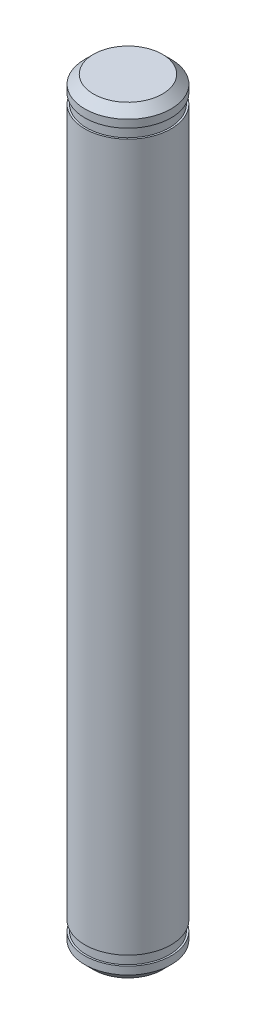
from build123d import *

# Parameters (mm, degrees)
CHAMFER_1_SIZE      = 1
CUT_EXTRUDE_START   = -3
SKETCH_2_R          = 5
SKETCH_2_R_2        = 4.8
CUT_EXTRUDE_1_DEPTH = 1.1


with BuildPart() as part:
    # 草图1 → 旋转1 (revolve)
    with BuildSketch(Plane.XY, mode=Mode.PRIVATE) as revolve_1_sk:
        Polygon((0, 44), (5, 44), (5, 29), (5, -29), (5, -44), (0, -44), align=None)
    revolve(revolve_1_sk.sketch.rotate(Axis((0, 44, 0), (0, -1, 0)), 180), axis=Axis((0, 44, 0), (0, -1, 0)))

    # 倒角1
    chamfer_1_edges = [part.edges().sort_by_distance(p)[0] for p in [
        (5, -44, 0),
        (5, 44, 0),
    ]]
    chamfer(chamfer_1_edges, length=CHAMFER_1_SIZE)

    # 草图2 → 切除-拉伸1 (cut)
    with BuildSketch(Plane(origin=(0, 44, 0), x_dir=(1, 0, 0), z_dir=(0, 1, 0)).offset(CUT_EXTRUDE_START)):
        with Locations(Location((0, 0, 0), (0, 0, 180))):
            Circle(SKETCH_2_R)
        with Locations(Location((0, 0, 0), (0, 0, 180))):
            Circle(SKETCH_2_R_2, mode=Mode.SUBTRACT)
    cut_extrude_1 = extrude(amount=CUT_EXTRUDE_1_DEPTH, mode=Mode.SUBTRACT)

    # 镜向1: 切除-拉伸1 across plane
    add(cut_extrude_1.mirror(Plane.ZX), mode=Mode.SUBTRACT)


solid = part.part
